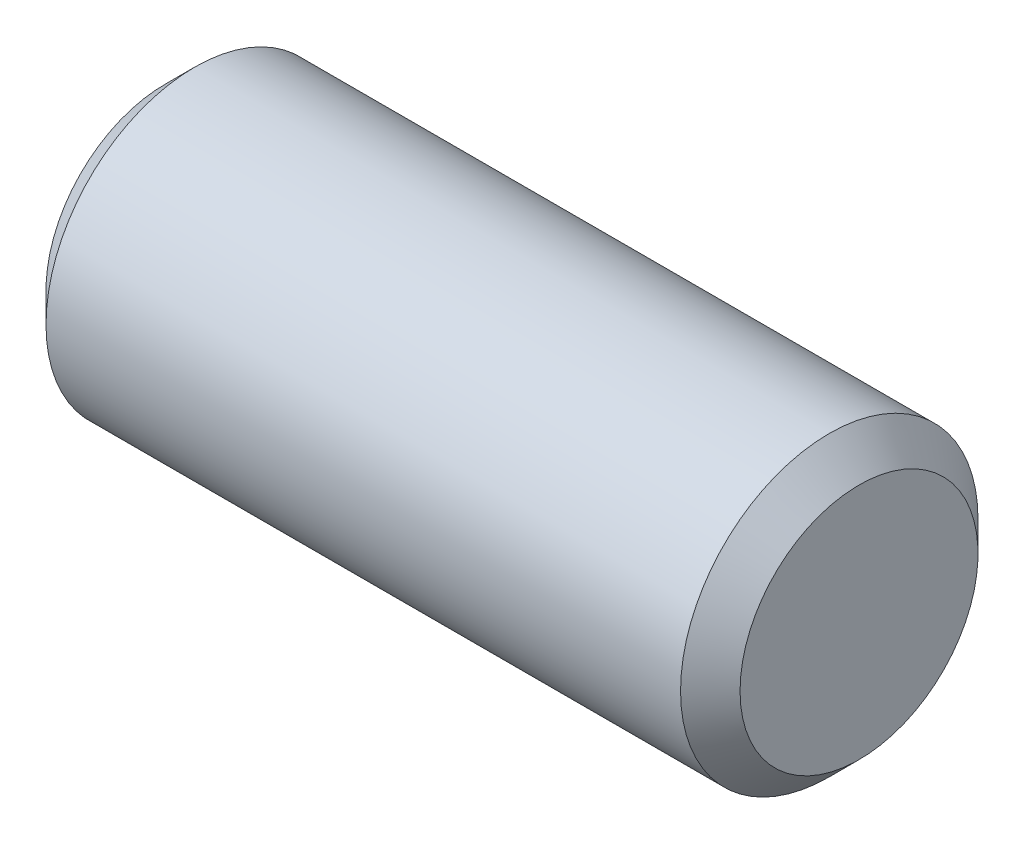
from build123d import *

# Parameters (mm, degrees)
EXTRUDE1_DEPTH      = 5.55625
EXTRUDE1_DEPTH_BACK = 5.55625
SKETCH2_R           = 2.38125
CHAMFER1_SIZE       = 0.47625


with BuildPart() as part:
    # Sketch2 → Extrude1 (new, two sides: drawn at the far end of the back side and taken through both)
    with BuildSketch(Plane(origin=(0, 0, 0), x_dir=(0, 0, -1), z_dir=(1, 0, 0)).offset(-EXTRUDE1_DEPTH_BACK)):
        Circle(SKETCH2_R)
    extrude(amount=EXTRUDE1_DEPTH + EXTRUDE1_DEPTH_BACK)

    # Chamfer1
    chamfer1_edges = [part.edges().sort_by_distance(p)[0] for p in [
        (-5.55625, 0, 2.38125),
        (5.55625, 0, 2.38125),
    ]]
    chamfer(chamfer1_edges, length=CHAMFER1_SIZE)


solid = part.part
